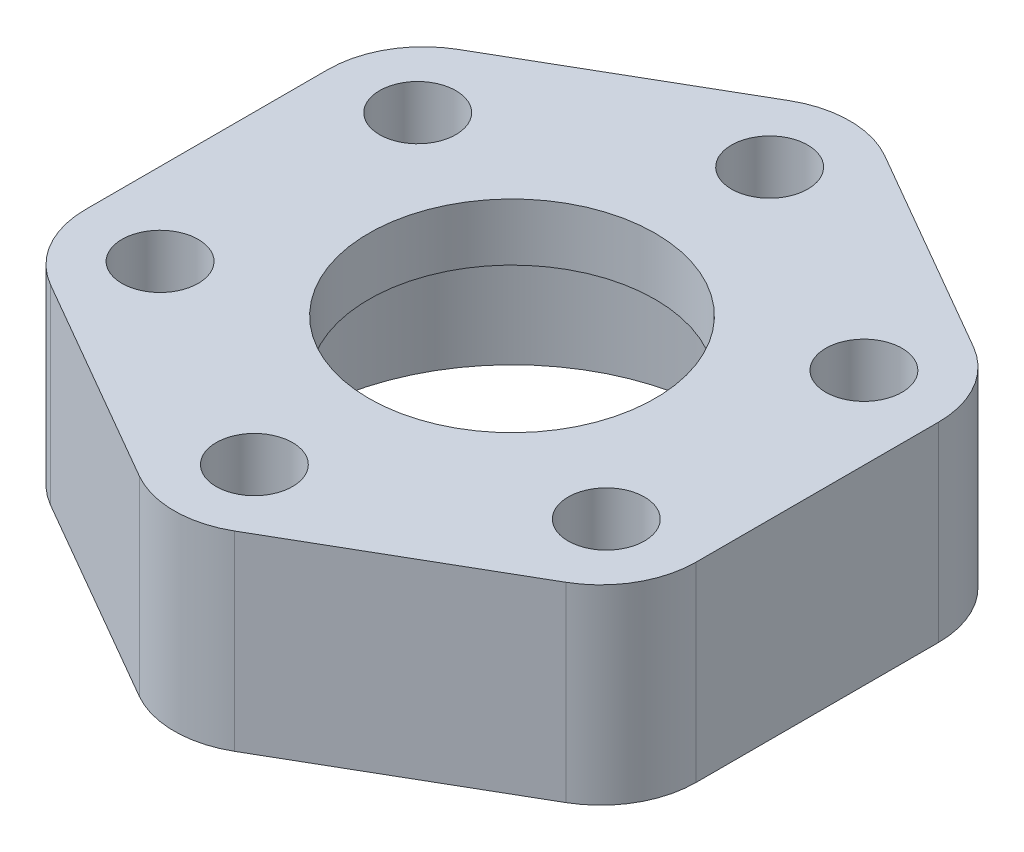
from build123d import *

# Parameters (mm, degrees)
SKETCH1_R           = 11
SKETCH1_R_2         = 2
BOSS_EXTRUDE1_DEPTH = 10
BOSS_EXTRUDE2_START = -3
SKETCH2_R           = 11
SKETCH2_R_2         = 7.5
BOSS_EXTRUDE2_DEPTH = 3


with BuildPart() as part:
    # Sketch1 → Boss-Extrude1 (new body)
    with BuildSketch(Plane(origin=(0, 0, 0), x_dir=(1, 0, 0), z_dir=(0, 1, 0))):
        with BuildLine():
            Line((-2.5, 17.031832941), (-13.5, 10.68097998))
            ThreePointArc((-13.5, 10.68097998), (-15.330127019, 8.850852961), (-16, 6.350852961))
            Line((-16, 6.350852961), (-16, -6.350852961))
            ThreePointArc((-16, -6.350852961), (-15.330127019, -8.850852961), (-13.5, -10.68097998))
            Line((-13.5, -10.68097998), (-2.5, -17.031832941))
            ThreePointArc((-2.5, -17.031832941), (0, -17.701705922), (2.5, -17.031832941))
            Line((2.5, -17.031832941), (13.5, -10.68097998))
            ThreePointArc((13.5, -10.68097998), (15.330127019, -8.850852961), (16, -6.350852961))
            Line((16, -6.350852961), (16, 6.350852961))
            ThreePointArc((16, 6.350852961), (15.330127019, 8.850852961), (13.5, 10.68097998))
            Line((13.5, 10.68097998), (2.5, 17.031832941))
            ThreePointArc((2.5, 17.031832941), (0, 17.701705922), (-2.5, 17.031832941))
        make_face()
        with Locations(Location((0, 0, 0), (0, 0, 270))):
            Circle(SKETCH1_R, mode=Mode.SUBTRACT)
        with Locations(Location((0, 13.5, 0), (0, 0, 270))):
            Circle(SKETCH1_R_2, mode=Mode.SUBTRACT)
        with Locations(Location((11.691342951, 6.75, 0), (0, 0, 270))):
            Circle(SKETCH1_R_2, mode=Mode.SUBTRACT)
        with Locations(Location((11.691342951, -6.75, 0), (0, 0, 270))):
            Circle(SKETCH1_R_2, mode=Mode.SUBTRACT)
        with Locations(Location((0, -13.5, 0), (0, 0, 270))):
            Circle(SKETCH1_R_2, mode=Mode.SUBTRACT)
        with Locations(Location((-11.691342951, -6.75, 0), (0, 0, 270))):
            Circle(SKETCH1_R_2, mode=Mode.SUBTRACT)
        with Locations(Location((-11.691342951, 6.75, 0), (0, 0, 270))):
            Circle(SKETCH1_R_2, mode=Mode.SUBTRACT)
    extrude(amount=BOSS_EXTRUDE1_DEPTH)

    # Sketch2 → Boss-Extrude2 (add)
    with BuildSketch(Plane(origin=(0, 10, 0), x_dir=(1, 0, 0), z_dir=(0, 1, 0)).offset(BOSS_EXTRUDE2_START)):
        with Locations(Location((0, 0, 0), (0, 0, 270))):
            Circle(SKETCH2_R)
        with Locations(Location((0, 0, 0), (0, 0, 270))):
            Circle(SKETCH2_R_2, mode=Mode.SUBTRACT)
    extrude(amount=BOSS_EXTRUDE2_DEPTH)


solid = part.part
